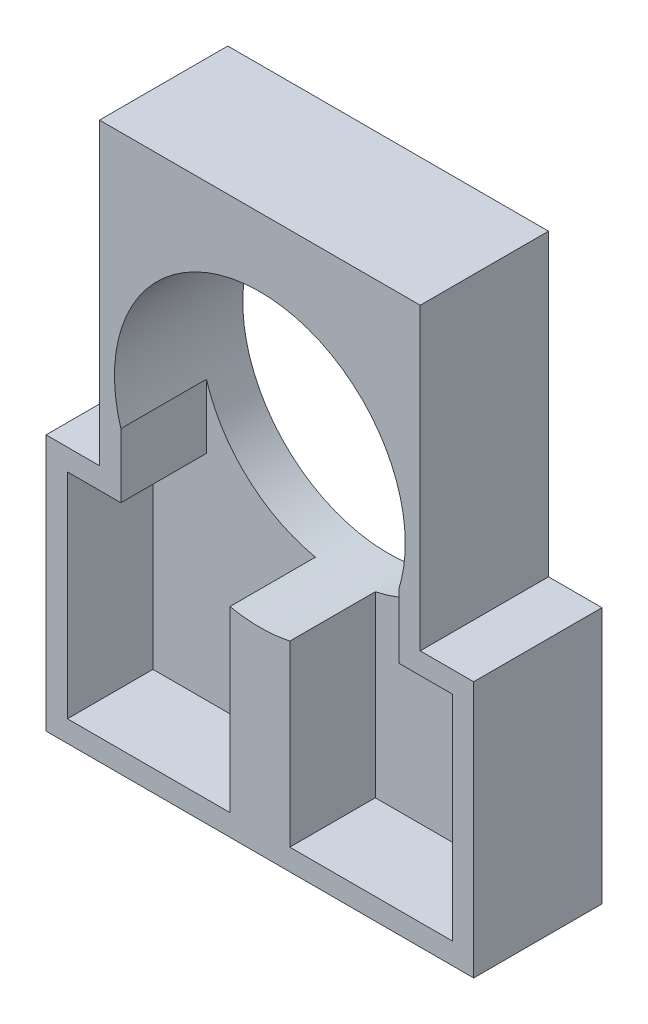
from build123d import *

# Parameters (mm, degrees)
EXTRUDE_1_DEPTH     = 30
SKETCH_2_R          = 34
CUT_EXTRUDE_1_DEPTH = 116.758369028
CUT_EXTRUDE_2_DEPTH = 20


with BuildPart() as part:
    # 草圖1 → 填料-伸長1 (new body)
    with BuildSketch(Plane.XY):
        Polygon((-50, -30), (50, -30), (50, 30), (37.5, 30), (37.5, 100), (-37.5, 100), (-37.5, 30), (-50, 30), align=None)
    extrude(amount=EXTRUDE_1_DEPTH)

    # 草圖2 → 除料-伸長1 (cut, through all)
    with BuildSketch(Plane.XY.offset(30)):
        with Locations((0, 50)):
            Circle(SKETCH_2_R)
    extrude(amount=-CUT_EXTRUDE_1_DEPTH, mode=Mode.SUBTRACT)

    # 草圖3 → 除料-伸長2 (cut)
    with BuildSketch(Plane.XY.offset(30)):
        with BuildLine():
            Line((-45, -25), (-7, -25))
            Line((-7, -25), (-7, 16.728390481))
            ThreePointArc((-7, 16.728390481), (-22.925968466, 24.892232877), (-32.5, 40.012507822))
            Line((-32.5, 40.012507822), (-32.5, 25))
            Line((-32.5, 25), (-45, 25))
            Line((-45, 25), (-45, -25))
        make_face()
    cut_extrude_2 = extrude(amount=-CUT_EXTRUDE_2_DEPTH, mode=Mode.SUBTRACT)

    # 鏡射1: 除料-伸長2 across plane
    add(cut_extrude_2.mirror(Plane(origin=(0, 0, 0), x_dir=(0, 0, 1), z_dir=(1, 0, 0))), mode=Mode.SUBTRACT)


solid = part.part
